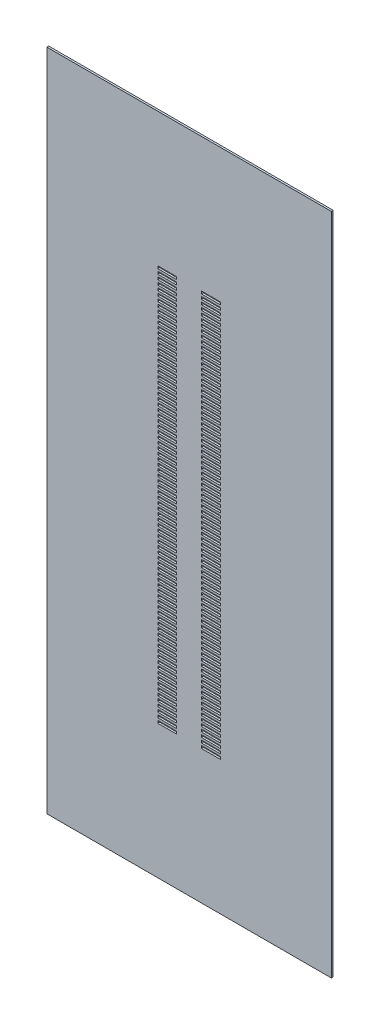
from build123d import *

# Parameters (mm, degrees)
SKETCH1_W          = 30
SKETCH1_H          = 70
SKETCH1_W_2        = 2
SKETCH1_H_2        = 0.27
BOSS_EXTRU_1_DEPTH = 0.2


with BuildPart() as part:
    # Sketch1 → Boss.-Extru.1 (new body)
    with BuildSketch(Plane.XY):
        with Locations((0, -20.885)):
            Rectangle(SKETCH1_W, SKETCH1_H)
        with Locations((-2.3, -0.135)):
            Rectangle(SKETCH1_W_2, SKETCH1_H_2, mode=Mode.SUBTRACT)
        with Locations((2.3, -0.135)):
            Rectangle(SKETCH1_W_2, SKETCH1_H_2, mode=Mode.SUBTRACT)
        with Locations((2.3, -0.635)):
            Rectangle(SKETCH1_W_2, SKETCH1_H_2, mode=Mode.SUBTRACT)
        with Locations((-2.3, -0.635)):
            Rectangle(SKETCH1_W_2, SKETCH1_H_2, mode=Mode.SUBTRACT)
        with Locations((2.3, -1.135)):
            Rectangle(SKETCH1_W_2, SKETCH1_H_2, mode=Mode.SUBTRACT)
        with Locations((-2.3, -1.135)):
            Rectangle(SKETCH1_W_2, SKETCH1_H_2, mode=Mode.SUBTRACT)
        with Locations((2.3, -1.635)):
            Rectangle(SKETCH1_W_2, SKETCH1_H_2, mode=Mode.SUBTRACT)
        with Locations((-2.3, -1.635)):
            Rectangle(SKETCH1_W_2, SKETCH1_H_2, mode=Mode.SUBTRACT)
        with Locations((2.3, -2.135)):
            Rectangle(SKETCH1_W_2, SKETCH1_H_2, mode=Mode.SUBTRACT)
        with Locations((-2.3, -2.135)):
            Rectangle(SKETCH1_W_2, SKETCH1_H_2, mode=Mode.SUBTRACT)
        with Locations((2.3, -2.635)):
            Rectangle(SKETCH1_W_2, SKETCH1_H_2, mode=Mode.SUBTRACT)
        with Locations((-2.3, -2.635)):
            Rectangle(SKETCH1_W_2, SKETCH1_H_2, mode=Mode.SUBTRACT)
        with Locations((2.3, -3.135)):
            Rectangle(SKETCH1_W_2, SKETCH1_H_2, mode=Mode.SUBTRACT)
        with Locations((-2.3, -3.135)):
            Rectangle(SKETCH1_W_2, SKETCH1_H_2, mode=Mode.SUBTRACT)
        with Locations((2.3, -3.635)):
            Rectangle(SKETCH1_W_2, SKETCH1_H_2, mode=Mode.SUBTRACT)
        with Locations((-2.3, -3.635)):
            Rectangle(SKETCH1_W_2, SKETCH1_H_2, mode=Mode.SUBTRACT)
        with Locations((2.3, -4.135)):
            Rectangle(SKETCH1_W_2, SKETCH1_H_2, mode=Mode.SUBTRACT)
        with Locations((-2.3, -4.135)):
            Rectangle(SKETCH1_W_2, SKETCH1_H_2, mode=Mode.SUBTRACT)
        with Locations((2.3, -4.635)):
            Rectangle(SKETCH1_W_2, SKETCH1_H_2, mode=Mode.SUBTRACT)
        with Locations((-2.3, -4.635)):
            Rectangle(SKETCH1_W_2, SKETCH1_H_2, mode=Mode.SUBTRACT)
        with Locations((2.3, -5.135)):
            Rectangle(SKETCH1_W_2, SKETCH1_H_2, mode=Mode.SUBTRACT)
        with Locations((-2.3, -5.135)):
            Rectangle(SKETCH1_W_2, SKETCH1_H_2, mode=Mode.SUBTRACT)
        with Locations((2.3, -5.635)):
            Rectangle(SKETCH1_W_2, SKETCH1_H_2, mode=Mode.SUBTRACT)
        with Locations((-2.3, -5.635)):
            Rectangle(SKETCH1_W_2, SKETCH1_H_2, mode=Mode.SUBTRACT)
        with Locations((2.3, -6.135)):
            Rectangle(SKETCH1_W_2, SKETCH1_H_2, mode=Mode.SUBTRACT)
        with Locations((-2.3, -6.135)):
            Rectangle(SKETCH1_W_2, SKETCH1_H_2, mode=Mode.SUBTRACT)
        with Locations((2.3, -6.635)):
            Rectangle(SKETCH1_W_2, SKETCH1_H_2, mode=Mode.SUBTRACT)
        with Locations((-2.3, -6.635)):
            Rectangle(SKETCH1_W_2, SKETCH1_H_2, mode=Mode.SUBTRACT)
        with Locations((2.3, -7.135)):
            Rectangle(SKETCH1_W_2, SKETCH1_H_2, mode=Mode.SUBTRACT)
        with Locations((-2.3, -7.135)):
            Rectangle(SKETCH1_W_2, SKETCH1_H_2, mode=Mode.SUBTRACT)
        with Locations((2.3, -7.635)):
            Rectangle(SKETCH1_W_2, SKETCH1_H_2, mode=Mode.SUBTRACT)
        with Locations((-2.3, -7.635)):
            Rectangle(SKETCH1_W_2, SKETCH1_H_2, mode=Mode.SUBTRACT)
        with Locations((2.3, -8.135)):
            Rectangle(SKETCH1_W_2, SKETCH1_H_2, mode=Mode.SUBTRACT)
        with Locations((-2.3, -8.135)):
            Rectangle(SKETCH1_W_2, SKETCH1_H_2, mode=Mode.SUBTRACT)
        with Locations((2.3, -8.635)):
            Rectangle(SKETCH1_W_2, SKETCH1_H_2, mode=Mode.SUBTRACT)
        with Locations((-2.3, -8.635)):
            Rectangle(SKETCH1_W_2, SKETCH1_H_2, mode=Mode.SUBTRACT)
        with Locations((2.3, -9.135)):
            Rectangle(SKETCH1_W_2, SKETCH1_H_2, mode=Mode.SUBTRACT)
        with Locations((-2.3, -9.135)):
            Rectangle(SKETCH1_W_2, SKETCH1_H_2, mode=Mode.SUBTRACT)
        with Locations((2.3, -9.635)):
            Rectangle(SKETCH1_W_2, SKETCH1_H_2, mode=Mode.SUBTRACT)
        with Locations((-2.3, -9.635)):
            Rectangle(SKETCH1_W_2, SKETCH1_H_2, mode=Mode.SUBTRACT)
        with Locations((2.3, -10.135)):
            Rectangle(SKETCH1_W_2, SKETCH1_H_2, mode=Mode.SUBTRACT)
        with Locations((-2.3, -10.135)):
            Rectangle(SKETCH1_W_2, SKETCH1_H_2, mode=Mode.SUBTRACT)
        with Locations((2.3, -10.635)):
            Rectangle(SKETCH1_W_2, SKETCH1_H_2, mode=Mode.SUBTRACT)
        with Locations((-2.3, -10.635)):
            Rectangle(SKETCH1_W_2, SKETCH1_H_2, mode=Mode.SUBTRACT)
        with Locations((2.3, -11.135)):
            Rectangle(SKETCH1_W_2, SKETCH1_H_2, mode=Mode.SUBTRACT)
        with Locations((-2.3, -11.135)):
            Rectangle(SKETCH1_W_2, SKETCH1_H_2, mode=Mode.SUBTRACT)
        with Locations((2.3, -11.635)):
            Rectangle(SKETCH1_W_2, SKETCH1_H_2, mode=Mode.SUBTRACT)
        with Locations((-2.3, -11.635)):
            Rectangle(SKETCH1_W_2, SKETCH1_H_2, mode=Mode.SUBTRACT)
        with Locations((2.3, -12.135)):
            Rectangle(SKETCH1_W_2, SKETCH1_H_2, mode=Mode.SUBTRACT)
        with Locations((-2.3, -12.135)):
            Rectangle(SKETCH1_W_2, SKETCH1_H_2, mode=Mode.SUBTRACT)
        with Locations((2.3, -12.635)):
            Rectangle(SKETCH1_W_2, SKETCH1_H_2, mode=Mode.SUBTRACT)
        with Locations((-2.3, -12.635)):
            Rectangle(SKETCH1_W_2, SKETCH1_H_2, mode=Mode.SUBTRACT)
        with Locations((2.3, -13.135)):
            Rectangle(SKETCH1_W_2, SKETCH1_H_2, mode=Mode.SUBTRACT)
        with Locations((-2.3, -13.135)):
            Rectangle(SKETCH1_W_2, SKETCH1_H_2, mode=Mode.SUBTRACT)
        with Locations((2.3, -13.635)):
            Rectangle(SKETCH1_W_2, SKETCH1_H_2, mode=Mode.SUBTRACT)
        with Locations((-2.3, -13.635)):
            Rectangle(SKETCH1_W_2, SKETCH1_H_2, mode=Mode.SUBTRACT)
        with Locations((2.3, -14.135)):
            Rectangle(SKETCH1_W_2, SKETCH1_H_2, mode=Mode.SUBTRACT)
        with Locations((-2.3, -14.135)):
            Rectangle(SKETCH1_W_2, SKETCH1_H_2, mode=Mode.SUBTRACT)
        with Locations((2.3, -14.635)):
            Rectangle(SKETCH1_W_2, SKETCH1_H_2, mode=Mode.SUBTRACT)
        with Locations((-2.3, -14.635)):
            Rectangle(SKETCH1_W_2, SKETCH1_H_2, mode=Mode.SUBTRACT)
        with Locations((2.3, -15.135)):
            Rectangle(SKETCH1_W_2, SKETCH1_H_2, mode=Mode.SUBTRACT)
        with Locations((-2.3, -15.135)):
            Rectangle(SKETCH1_W_2, SKETCH1_H_2, mode=Mode.SUBTRACT)
        with Locations((2.3, -15.635)):
            Rectangle(SKETCH1_W_2, SKETCH1_H_2, mode=Mode.SUBTRACT)
        with Locations((-2.3, -15.635)):
            Rectangle(SKETCH1_W_2, SKETCH1_H_2, mode=Mode.SUBTRACT)
        with Locations((2.3, -16.135)):
            Rectangle(SKETCH1_W_2, SKETCH1_H_2, mode=Mode.SUBTRACT)
        with Locations((-2.3, -16.135)):
            Rectangle(SKETCH1_W_2, SKETCH1_H_2, mode=Mode.SUBTRACT)
        with Locations((2.3, -16.635)):
            Rectangle(SKETCH1_W_2, SKETCH1_H_2, mode=Mode.SUBTRACT)
        with Locations((-2.3, -16.635)):
            Rectangle(SKETCH1_W_2, SKETCH1_H_2, mode=Mode.SUBTRACT)
        with Locations((2.3, -17.135)):
            Rectangle(SKETCH1_W_2, SKETCH1_H_2, mode=Mode.SUBTRACT)
        with Locations((-2.3, -17.135)):
            Rectangle(SKETCH1_W_2, SKETCH1_H_2, mode=Mode.SUBTRACT)
        with Locations((2.3, -17.635)):
            Rectangle(SKETCH1_W_2, SKETCH1_H_2, mode=Mode.SUBTRACT)
        with Locations((-2.3, -17.635)):
            Rectangle(SKETCH1_W_2, SKETCH1_H_2, mode=Mode.SUBTRACT)
        with Locations((2.3, -18.135)):
            Rectangle(SKETCH1_W_2, SKETCH1_H_2, mode=Mode.SUBTRACT)
        with Locations((-2.3, -18.135)):
            Rectangle(SKETCH1_W_2, SKETCH1_H_2, mode=Mode.SUBTRACT)
        with Locations((2.3, -18.635)):
            Rectangle(SKETCH1_W_2, SKETCH1_H_2, mode=Mode.SUBTRACT)
        with Locations((-2.3, -18.635)):
            Rectangle(SKETCH1_W_2, SKETCH1_H_2, mode=Mode.SUBTRACT)
        with Locations((2.3, -19.135)):
            Rectangle(SKETCH1_W_2, SKETCH1_H_2, mode=Mode.SUBTRACT)
        with Locations((-2.3, -19.135)):
            Rectangle(SKETCH1_W_2, SKETCH1_H_2, mode=Mode.SUBTRACT)
        with Locations((2.3, -19.635)):
            Rectangle(SKETCH1_W_2, SKETCH1_H_2, mode=Mode.SUBTRACT)
        with Locations((-2.3, -19.635)):
            Rectangle(SKETCH1_W_2, SKETCH1_H_2, mode=Mode.SUBTRACT)
        with Locations((2.3, -20.135)):
            Rectangle(SKETCH1_W_2, SKETCH1_H_2, mode=Mode.SUBTRACT)
        with Locations((-2.3, -20.135)):
            Rectangle(SKETCH1_W_2, SKETCH1_H_2, mode=Mode.SUBTRACT)
        with Locations((2.3, -20.635)):
            Rectangle(SKETCH1_W_2, SKETCH1_H_2, mode=Mode.SUBTRACT)
        with Locations((-2.3, -20.635)):
            Rectangle(SKETCH1_W_2, SKETCH1_H_2, mode=Mode.SUBTRACT)
        with Locations((2.3, -21.135)):
            Rectangle(SKETCH1_W_2, SKETCH1_H_2, mode=Mode.SUBTRACT)
        with Locations((-2.3, -21.135)):
            Rectangle(SKETCH1_W_2, SKETCH1_H_2, mode=Mode.SUBTRACT)
        with Locations((2.3, -21.635)):
            Rectangle(SKETCH1_W_2, SKETCH1_H_2, mode=Mode.SUBTRACT)
        with Locations((-2.3, -21.635)):
            Rectangle(SKETCH1_W_2, SKETCH1_H_2, mode=Mode.SUBTRACT)
        with Locations((2.3, -22.135)):
            Rectangle(SKETCH1_W_2, SKETCH1_H_2, mode=Mode.SUBTRACT)
        with Locations((-2.3, -22.135)):
            Rectangle(SKETCH1_W_2, SKETCH1_H_2, mode=Mode.SUBTRACT)
        with Locations((2.3, -22.635)):
            Rectangle(SKETCH1_W_2, SKETCH1_H_2, mode=Mode.SUBTRACT)
        with Locations((-2.3, -22.635)):
            Rectangle(SKETCH1_W_2, SKETCH1_H_2, mode=Mode.SUBTRACT)
        with Locations((2.3, -23.135)):
            Rectangle(SKETCH1_W_2, SKETCH1_H_2, mode=Mode.SUBTRACT)
        with Locations((-2.3, -23.135)):
            Rectangle(SKETCH1_W_2, SKETCH1_H_2, mode=Mode.SUBTRACT)
        with Locations((2.3, -23.635)):
            Rectangle(SKETCH1_W_2, SKETCH1_H_2, mode=Mode.SUBTRACT)
        with Locations((-2.3, -23.635)):
            Rectangle(SKETCH1_W_2, SKETCH1_H_2, mode=Mode.SUBTRACT)
        with Locations((2.3, -24.135)):
            Rectangle(SKETCH1_W_2, SKETCH1_H_2, mode=Mode.SUBTRACT)
        with Locations((-2.3, -24.135)):
            Rectangle(SKETCH1_W_2, SKETCH1_H_2, mode=Mode.SUBTRACT)
        with Locations((2.3, -24.635)):
            Rectangle(SKETCH1_W_2, SKETCH1_H_2, mode=Mode.SUBTRACT)
        with Locations((-2.3, -24.635)):
            Rectangle(SKETCH1_W_2, SKETCH1_H_2, mode=Mode.SUBTRACT)
        with Locations((2.3, -25.135)):
            Rectangle(SKETCH1_W_2, SKETCH1_H_2, mode=Mode.SUBTRACT)
        with Locations((-2.3, -25.135)):
            Rectangle(SKETCH1_W_2, SKETCH1_H_2, mode=Mode.SUBTRACT)
        with Locations((2.3, -25.635)):
            Rectangle(SKETCH1_W_2, SKETCH1_H_2, mode=Mode.SUBTRACT)
        with Locations((-2.3, -25.635)):
            Rectangle(SKETCH1_W_2, SKETCH1_H_2, mode=Mode.SUBTRACT)
        with Locations((2.3, -26.135)):
            Rectangle(SKETCH1_W_2, SKETCH1_H_2, mode=Mode.SUBTRACT)
        with Locations((-2.3, -26.135)):
            Rectangle(SKETCH1_W_2, SKETCH1_H_2, mode=Mode.SUBTRACT)
        with Locations((2.3, -26.635)):
            Rectangle(SKETCH1_W_2, SKETCH1_H_2, mode=Mode.SUBTRACT)
        with Locations((-2.3, -26.635)):
            Rectangle(SKETCH1_W_2, SKETCH1_H_2, mode=Mode.SUBTRACT)
        with Locations((2.3, -27.135)):
            Rectangle(SKETCH1_W_2, SKETCH1_H_2, mode=Mode.SUBTRACT)
        with Locations((-2.3, -27.135)):
            Rectangle(SKETCH1_W_2, SKETCH1_H_2, mode=Mode.SUBTRACT)
        with Locations((2.3, -27.635)):
            Rectangle(SKETCH1_W_2, SKETCH1_H_2, mode=Mode.SUBTRACT)
        with Locations((-2.3, -27.635)):
            Rectangle(SKETCH1_W_2, SKETCH1_H_2, mode=Mode.SUBTRACT)
        with Locations((2.3, -28.135)):
            Rectangle(SKETCH1_W_2, SKETCH1_H_2, mode=Mode.SUBTRACT)
        with Locations((-2.3, -28.135)):
            Rectangle(SKETCH1_W_2, SKETCH1_H_2, mode=Mode.SUBTRACT)
        with Locations((2.3, -28.635)):
            Rectangle(SKETCH1_W_2, SKETCH1_H_2, mode=Mode.SUBTRACT)
        with Locations((-2.3, -28.635)):
            Rectangle(SKETCH1_W_2, SKETCH1_H_2, mode=Mode.SUBTRACT)
        with Locations((2.3, -29.135)):
            Rectangle(SKETCH1_W_2, SKETCH1_H_2, mode=Mode.SUBTRACT)
        with Locations((-2.3, -29.135)):
            Rectangle(SKETCH1_W_2, SKETCH1_H_2, mode=Mode.SUBTRACT)
        with Locations((2.3, -29.635)):
            Rectangle(SKETCH1_W_2, SKETCH1_H_2, mode=Mode.SUBTRACT)
        with Locations((-2.3, -29.635)):
            Rectangle(SKETCH1_W_2, SKETCH1_H_2, mode=Mode.SUBTRACT)
        with Locations((2.3, -30.135)):
            Rectangle(SKETCH1_W_2, SKETCH1_H_2, mode=Mode.SUBTRACT)
        with Locations((-2.3, -30.135)):
            Rectangle(SKETCH1_W_2, SKETCH1_H_2, mode=Mode.SUBTRACT)
        with Locations((2.3, -30.635)):
            Rectangle(SKETCH1_W_2, SKETCH1_H_2, mode=Mode.SUBTRACT)
        with Locations((-2.3, -30.635)):
            Rectangle(SKETCH1_W_2, SKETCH1_H_2, mode=Mode.SUBTRACT)
        with Locations((2.3, -31.135)):
            Rectangle(SKETCH1_W_2, SKETCH1_H_2, mode=Mode.SUBTRACT)
        with Locations((-2.3, -31.135)):
            Rectangle(SKETCH1_W_2, SKETCH1_H_2, mode=Mode.SUBTRACT)
        with Locations((2.3, -31.635)):
            Rectangle(SKETCH1_W_2, SKETCH1_H_2, mode=Mode.SUBTRACT)
        with Locations((-2.3, -31.635)):
            Rectangle(SKETCH1_W_2, SKETCH1_H_2, mode=Mode.SUBTRACT)
        with Locations((2.3, -32.135)):
            Rectangle(SKETCH1_W_2, SKETCH1_H_2, mode=Mode.SUBTRACT)
        with Locations((-2.3, -32.135)):
            Rectangle(SKETCH1_W_2, SKETCH1_H_2, mode=Mode.SUBTRACT)
        with Locations((2.3, -32.635)):
            Rectangle(SKETCH1_W_2, SKETCH1_H_2, mode=Mode.SUBTRACT)
        with Locations((-2.3, -32.635)):
            Rectangle(SKETCH1_W_2, SKETCH1_H_2, mode=Mode.SUBTRACT)
        with Locations((2.3, -33.135)):
            Rectangle(SKETCH1_W_2, SKETCH1_H_2, mode=Mode.SUBTRACT)
        with Locations((-2.3, -33.135)):
            Rectangle(SKETCH1_W_2, SKETCH1_H_2, mode=Mode.SUBTRACT)
        with Locations((2.3, -33.635)):
            Rectangle(SKETCH1_W_2, SKETCH1_H_2, mode=Mode.SUBTRACT)
        with Locations((-2.3, -33.635)):
            Rectangle(SKETCH1_W_2, SKETCH1_H_2, mode=Mode.SUBTRACT)
        with Locations((2.3, -34.135)):
            Rectangle(SKETCH1_W_2, SKETCH1_H_2, mode=Mode.SUBTRACT)
        with Locations((-2.3, -34.135)):
            Rectangle(SKETCH1_W_2, SKETCH1_H_2, mode=Mode.SUBTRACT)
        with Locations((2.3, -34.635)):
            Rectangle(SKETCH1_W_2, SKETCH1_H_2, mode=Mode.SUBTRACT)
        with Locations((-2.3, -34.635)):
            Rectangle(SKETCH1_W_2, SKETCH1_H_2, mode=Mode.SUBTRACT)
        with Locations((2.3, -35.135)):
            Rectangle(SKETCH1_W_2, SKETCH1_H_2, mode=Mode.SUBTRACT)
        with Locations((-2.3, -35.135)):
            Rectangle(SKETCH1_W_2, SKETCH1_H_2, mode=Mode.SUBTRACT)
        with Locations((2.3, -35.635)):
            Rectangle(SKETCH1_W_2, SKETCH1_H_2, mode=Mode.SUBTRACT)
        with Locations((-2.3, -35.635)):
            Rectangle(SKETCH1_W_2, SKETCH1_H_2, mode=Mode.SUBTRACT)
        with Locations((2.3, -36.135)):
            Rectangle(SKETCH1_W_2, SKETCH1_H_2, mode=Mode.SUBTRACT)
        with Locations((-2.3, -36.135)):
            Rectangle(SKETCH1_W_2, SKETCH1_H_2, mode=Mode.SUBTRACT)
        with Locations((2.3, -36.635)):
            Rectangle(SKETCH1_W_2, SKETCH1_H_2, mode=Mode.SUBTRACT)
        with Locations((-2.3, -36.635)):
            Rectangle(SKETCH1_W_2, SKETCH1_H_2, mode=Mode.SUBTRACT)
        with Locations((2.3, -37.135)):
            Rectangle(SKETCH1_W_2, SKETCH1_H_2, mode=Mode.SUBTRACT)
        with Locations((-2.3, -37.135)):
            Rectangle(SKETCH1_W_2, SKETCH1_H_2, mode=Mode.SUBTRACT)
        with Locations((2.3, -37.635)):
            Rectangle(SKETCH1_W_2, SKETCH1_H_2, mode=Mode.SUBTRACT)
        with Locations((-2.3, -37.635)):
            Rectangle(SKETCH1_W_2, SKETCH1_H_2, mode=Mode.SUBTRACT)
        with Locations((2.3, -38.135)):
            Rectangle(SKETCH1_W_2, SKETCH1_H_2, mode=Mode.SUBTRACT)
        with Locations((-2.3, -38.135)):
            Rectangle(SKETCH1_W_2, SKETCH1_H_2, mode=Mode.SUBTRACT)
        with Locations((2.3, -38.635)):
            Rectangle(SKETCH1_W_2, SKETCH1_H_2, mode=Mode.SUBTRACT)
        with Locations((-2.3, -38.635)):
            Rectangle(SKETCH1_W_2, SKETCH1_H_2, mode=Mode.SUBTRACT)
        with Locations((2.3, -39.135)):
            Rectangle(SKETCH1_W_2, SKETCH1_H_2, mode=Mode.SUBTRACT)
        with Locations((-2.3, -39.135)):
            Rectangle(SKETCH1_W_2, SKETCH1_H_2, mode=Mode.SUBTRACT)
        with Locations((2.3, -39.635)):
            Rectangle(SKETCH1_W_2, SKETCH1_H_2, mode=Mode.SUBTRACT)
        with Locations((-2.3, -39.635)):
            Rectangle(SKETCH1_W_2, SKETCH1_H_2, mode=Mode.SUBTRACT)
        with Locations((2.3, -40.135)):
            Rectangle(SKETCH1_W_2, SKETCH1_H_2, mode=Mode.SUBTRACT)
        with Locations((-2.3, -40.135)):
            Rectangle(SKETCH1_W_2, SKETCH1_H_2, mode=Mode.SUBTRACT)
        with Locations((2.3, -40.635)):
            Rectangle(SKETCH1_W_2, SKETCH1_H_2, mode=Mode.SUBTRACT)
        with Locations((-2.3, -40.635)):
            Rectangle(SKETCH1_W_2, SKETCH1_H_2, mode=Mode.SUBTRACT)
        with Locations((2.3, -41.135)):
            Rectangle(SKETCH1_W_2, SKETCH1_H_2, mode=Mode.SUBTRACT)
        with Locations((-2.3, -41.135)):
            Rectangle(SKETCH1_W_2, SKETCH1_H_2, mode=Mode.SUBTRACT)
        with Locations((2.3, -41.635)):
            Rectangle(SKETCH1_W_2, SKETCH1_H_2, mode=Mode.SUBTRACT)
        with Locations((-2.3, -41.635)):
            Rectangle(SKETCH1_W_2, SKETCH1_H_2, mode=Mode.SUBTRACT)
    extrude(amount=BOSS_EXTRU_1_DEPTH)


solid = part.part
